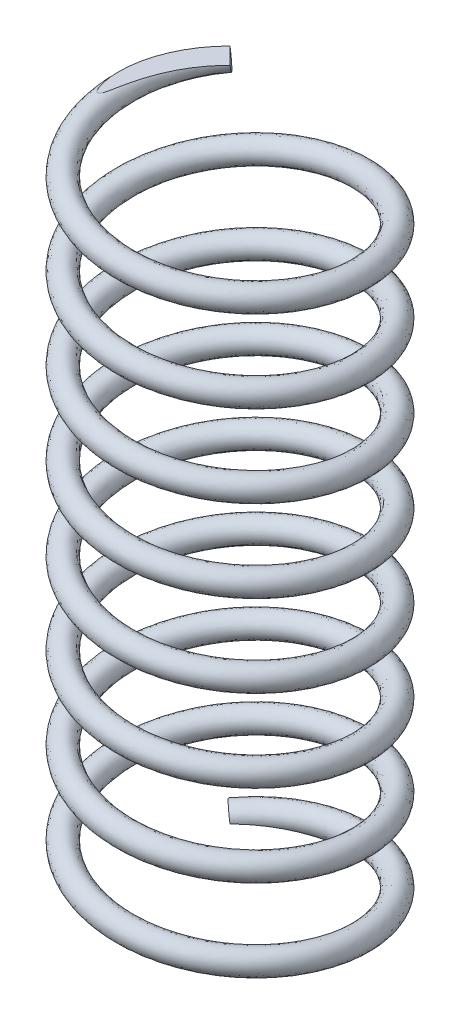
from build123d import *

# Parameters (mm, degrees)
SWEEP1_PITCH       = 6.35
SWEEP1_HEIGHT      = 50.8
SWEEP1_RADIUS      = 9.144
SWEEP1_START_ANGLE = -135
SKETCH2_R          = 0.9144
SKETCH4_W          = 30.024724247
SKETCH4_H          = 8.703817625
SKETCH4_W_2        = 33.590879234
SKETCH4_H_2        = 12.912136067
CUT_EXTRUDE2_DEPTH = 35.56


with BuildPart() as part:
    # Sweep1: sweep along a helix
    with BuildLine() as sweep1_path:
        add(Helix(SWEEP1_PITCH, SWEEP1_HEIGHT, SWEEP1_RADIUS, center=(0, 0, 0), direction=(0, 1, 0), lefthand=True, mode=Mode.PRIVATE).rotate(Axis((0, 0, 0), (0, 1, 0)), SWEEP1_START_ANGLE))
    # Sketch2 → Sweep1 (sweep)
    with BuildSketch(Plane(origin=(-6.465784407, 50.8, -6.465784407), x_dir=(-0.6943957947187106, -0.1085374763638939, -0.7113607358447103), z_dir=(0.7028270793720716, 0.10985532760340516, -0.7028270793719266))):
        Circle(SKETCH2_R)
    sweep(path=sweep1_path.line, is_frenet=True)

    # Sketch4 → Cut-Extrude2 (cut)
    with BuildSketch(Plane(origin=(17.78, 0, 0), x_dir=(0, 0, -1), z_dir=(1, 0, 0))):
        with Locations((3.586503471, -4.351908813)):
            Rectangle(SKETCH4_W, SKETCH4_H)
        with Locations((5.369580965, 57.256068034)):
            Rectangle(SKETCH4_W_2, SKETCH4_H_2)
    extrude(amount=-CUT_EXTRUDE2_DEPTH, mode=Mode.SUBTRACT)


solid = part.part
